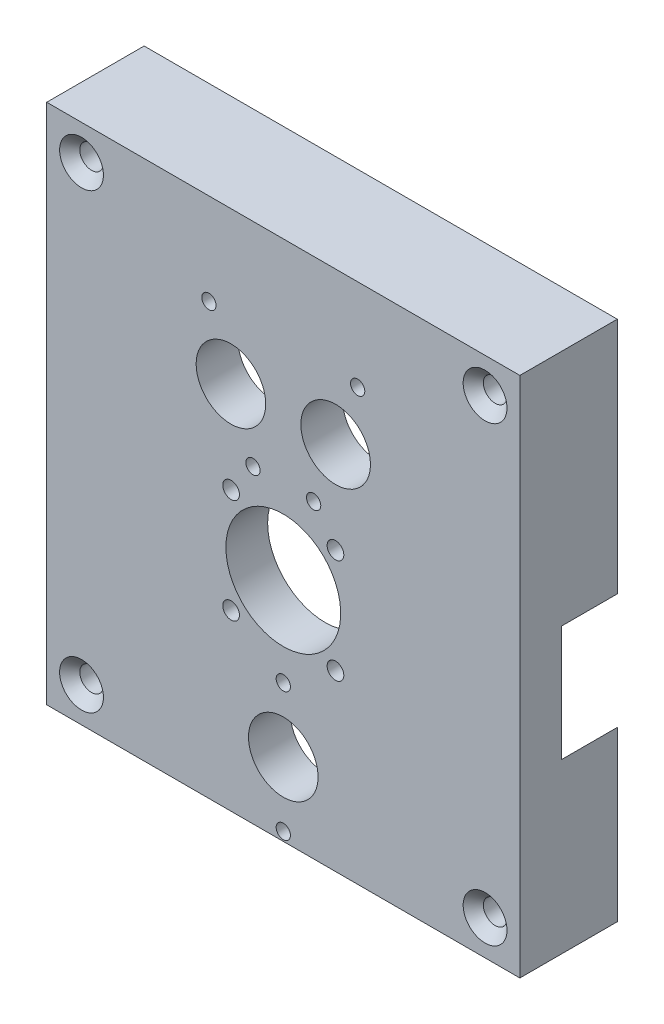
from build123d import *

# Parameters (mm, degrees)
SKETCH_1_W                    = 68
SKETCH_1_H                    = 75
EXTRUDE_1_DEPTH               = 14
SKETCH_2_R                    = 8.25
CUT_EXTRUDE_1_DEPTH           = 53.519044165
SKETCH_6_R                    = 35
CUT_EXTRUDE_3_DEPTH           = 8
HOLE_WIZARD_M2_2_D            = 2.4
HOLE_WIZARD_M2_2_DEPTH        = 6.35
HOLE_WIZARD_M2_2_CSINK_D      = 4.4
HOLE_WIZARD_M2_2_CSINK_ANGLE  = 90
HOLE_WIZARD_M2_2_TIP          = 0.721032743
HOLE_WIZARD_M2_5_1_AT_2_COUNT = 2
HOLE_WIZARD_M2_5_1_AT_2_PITCH = 18.5
HOLE_WIZARD_M2_5_2_D          = 2.05
HOLE_WIZARD_M2_5_2_DEPTH      = 6.35
HOLE_WIZARD_M2_5_2_TIP        = 0.615882135
SKETCH_19_R                   = 5
CUT_EXTRUDE_5_DEPTH           = 52.246951129
HOLE_WIZARD_M3_1_D            = 3.4
HOLE_WIZARD_M3_1_CSINK_D      = 6.3
HOLE_WIZARD_M3_1_CSINK_ANGLE  = 90


with BuildPart() as part:
    # 草圖1 → 填料-伸長1 (new body)
    with BuildSketch(Plane.XY):
        Rectangle(SKETCH_1_W, SKETCH_1_H)
    extrude(amount=EXTRUDE_1_DEPTH)

    # 草圖2 → 除料-伸長1 (cut, through all)
    with BuildSketch(Plane(origin=(0, 0, 0), x_dir=(-1, 0, 0), z_dir=(0, 0, -1))):
        with Locations((0, -5)):
            Circle(SKETCH_2_R)
    extrude(amount=-CUT_EXTRUDE_1_DEPTH, mode=Mode.SUBTRACT)

    # 草圖6 → 除料-伸長3 (cut)
    with BuildSketch(Plane(origin=(0, 0, 0), x_dir=(-1, 0, 0), z_dir=(0, 0, -1))):
        with Locations((0, -5)):
            Circle(SKETCH_6_R)
    extrude(amount=-CUT_EXTRUDE_3_DEPTH, mode=Mode.SUBTRACT)

    # M2 錐坑平頭螺釘的錐孔2
    with Locations(Plane(origin=(0, 0, 8), x_dir=(-1, 0, 0), z_dir=(0, 0, -1))):
        with Locations((-7.5, 2.5), (7.5, -12.5), (-7.5, -12.5), (7.5, 2.5)):
            CounterSinkHole(HOLE_WIZARD_M2_2_D / 2, HOLE_WIZARD_M2_2_CSINK_D / 2, depth=HOLE_WIZARD_M2_2_DEPTH, counter_sink_angle=HOLE_WIZARD_M2_2_CSINK_ANGLE)
            with Locations((0, 0, -(HOLE_WIZARD_M2_2_DEPTH + HOLE_WIZARD_M2_2_TIP / 2))):  # 118° drill point
                Cone(0, HOLE_WIZARD_M2_2_D / 2, HOLE_WIZARD_M2_2_TIP, mode=Mode.SUBTRACT)

    # 草圖13 → M2.5 螺紋孔1 (revolve, cut)
    with BuildSketch(Plane(origin=(-10.688129479, 24.3653944, 8), x_dir=(0, 1, 0), z_dir=(1, 0, 0))):
        Polygon((0, 0), (0, 6.965882135), (1.025, 6.35), (1.025, 0), align=None)
    hole_wizard_m2_5_1 = revolve(axis=Axis((-10.688129479, 24.3653944, 1.65), (0, 0, 1)), mode=Mode.SUBTRACT)

    # M2.5 螺紋孔1 at 2: M2.5 螺紋孔1 ×2
    with Locations(*[Vector(0.34202014332566283, -0.9396926207859105, 0) * (i * HOLE_WIZARD_M2_5_1_AT_2_PITCH) for i in range(1, HOLE_WIZARD_M2_5_1_AT_2_COUNT)]):
        add(hole_wizard_m2_5_1, mode=Mode.SUBTRACT)

    # 鏡射1: M2.5 螺紋孔1 across plane
    add(hole_wizard_m2_5_1.mirror(Plane(origin=(0, 0, 0), x_dir=(0, 0, 1), z_dir=(1, 0, 0))), mode=Mode.SUBTRACT)

    # 鏡射1 copy 1 sketch → 鏡射1 copy 1 (revolve, cut)
    with BuildSketch(Plane(origin=(4.360756827, 6.981080915, 8), x_dir=(0, 1, 0), z_dir=(-1, 0, 0))):
        Polygon((0, 0), (0, -6.965882135), (1.025, -6.35), (1.025, 0), align=None)
    revolve(axis=Axis((4.360756827, 6.981080915, 1.65), (0, 0, -1)), mode=Mode.SUBTRACT)

    # M2.5 螺紋孔2
    with Locations(Plane(origin=(0, 0, 8), x_dir=(-1, 0, 0), z_dir=(0, 0, -1))):
        with Locations((0, -17.75), (0, -36.25)):
            Hole(HOLE_WIZARD_M2_5_2_D / 2, depth=HOLE_WIZARD_M2_5_2_DEPTH)
            with Locations((0, 0, -(HOLE_WIZARD_M2_5_2_DEPTH + HOLE_WIZARD_M2_5_2_TIP / 2))):  # 118° drill point
                Cone(0, HOLE_WIZARD_M2_5_2_D / 2, HOLE_WIZARD_M2_5_2_TIP, mode=Mode.SUBTRACT)

    # 草圖19 → 除料-伸長5 (cut, through all)
    with BuildSketch(Plane(origin=(0, 0, 8), x_dir=(-1, 0, 0), z_dir=(0, 0, -1))):
        with Locations((-7.524443153, 15.673237657)):
            Circle(SKETCH_19_R)
        with Locations((7.524443153, 15.673237657)):
            Circle(SKETCH_19_R)
        with Locations((0, -27)):
            Circle(SKETCH_19_R)
    extrude(amount=-CUT_EXTRUDE_5_DEPTH, mode=Mode.SUBTRACT)

    # M3 錐坑平頭螺釘的錐孔1 (through all)
    with Locations(Plane.XY.offset(14)):
        with Locations((-29, 32.5), (-29, -32.5), (29, -32.5), (29, 32.5)):
            CounterSinkHole(HOLE_WIZARD_M3_1_D / 2, HOLE_WIZARD_M3_1_CSINK_D / 2, counter_sink_angle=HOLE_WIZARD_M3_1_CSINK_ANGLE)


solid = part.part
